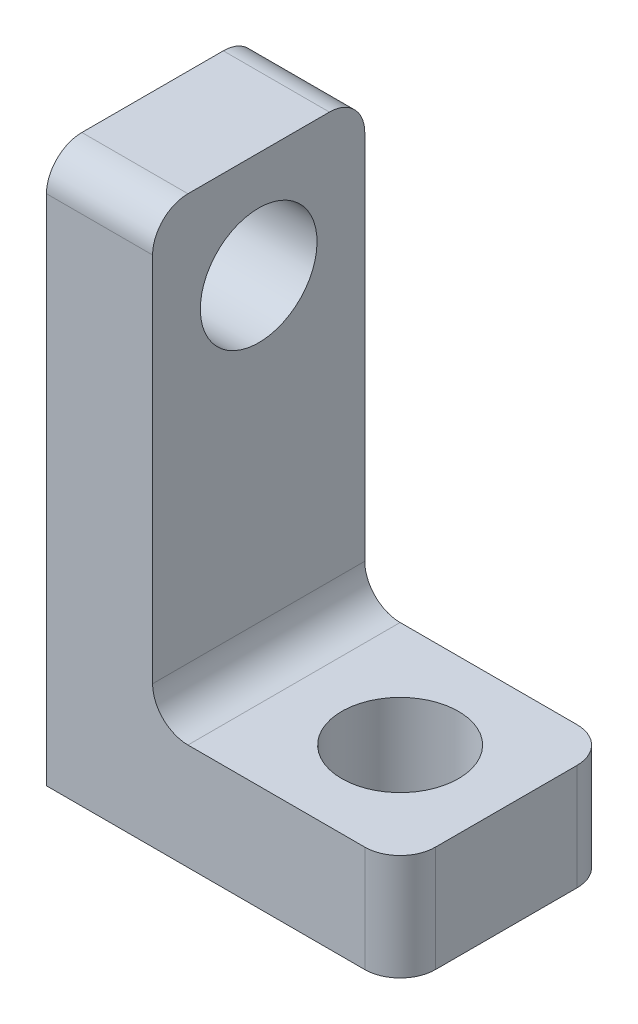
from build123d import *

# Parameters (mm, degrees)
EXTRUDE_1_DEPTH     = 6
SKETCH_2_R          = 1.65
CUT_EXTRUDE_1_DEPTH = 6
SKETCH_3_R          = 1.65
CUT_EXTRUDE_2_DEPTH = 6
FILLET_1_R          = 1


with BuildPart() as part:
    # 草图1 → 凸台-拉伸1 (new body)
    with BuildSketch(Plane.XY):
        Polygon((10, 0), (0, 0), (0, 15.5), (3, 15.5), (3, 3), (10, 3), align=None)
    extrude(amount=EXTRUDE_1_DEPTH)

    # 草图2 → 切除-拉伸1 (cut)
    with BuildSketch(Plane(origin=(3, 0, 0), x_dir=(0, 0, -1), z_dir=(1, 0, 0))):
        with Locations(Location((-3, 12.5, 0), (0, 0, 90))):
            Circle(SKETCH_2_R)
    extrude(amount=-CUT_EXTRUDE_1_DEPTH, mode=Mode.SUBTRACT)

    # 草图3 → 切除-拉伸2 (cut)
    with BuildSketch(Plane(origin=(0, 3, 0), x_dir=(1, 0, 0), z_dir=(0, 1, 0))):
        with Locations(Location((7, -3, 0), (0, 0, 270))):
            Circle(SKETCH_3_R)
    extrude(amount=-CUT_EXTRUDE_2_DEPTH, mode=Mode.SUBTRACT)

    # 圆角1
    fillet_1_edges = [part.edges().sort_by_distance(p)[0] for p in [
        (3, 3, 3),
        (1.5, 15.5, 6),
        (10, 1.5, 6),
        (1.5, 15.5, 0),
        (10, 1.5, 0),
    ]]
    fillet(fillet_1_edges, radius=FILLET_1_R)


solid = part.part
